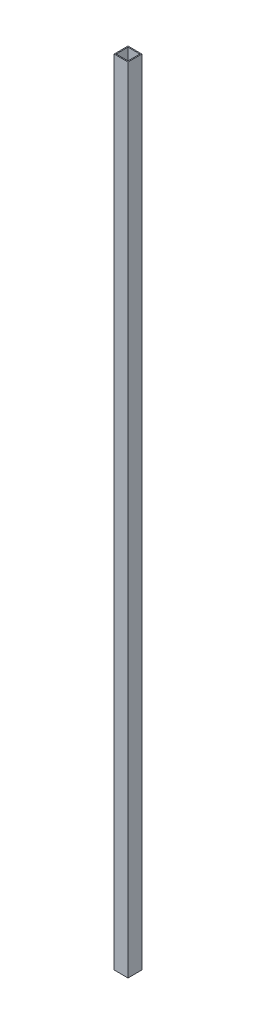
from build123d import *

# Parameters (mm, degrees)
SKETCH1_W           = 14
SKETCH1_H           = 14
SKETCH1_W_2         = 12
SKETCH1_H_2         = 12
BOSS_EXTRUDE1_DEPTH = 800


with BuildPart() as part:
    # Sketch1 → Boss-Extrude1 (new body)
    with BuildSketch(Plane(origin=(0, 0, 0), x_dir=(1, 0, 0), z_dir=(0, 1, 0))):
        with Locations((-7, -7)):
            Rectangle(SKETCH1_W, SKETCH1_H)
        with Locations((-7, -7)):
            Rectangle(SKETCH1_W_2, SKETCH1_H_2, mode=Mode.SUBTRACT)
    extrude(amount=BOSS_EXTRUDE1_DEPTH)


solid = part.part
